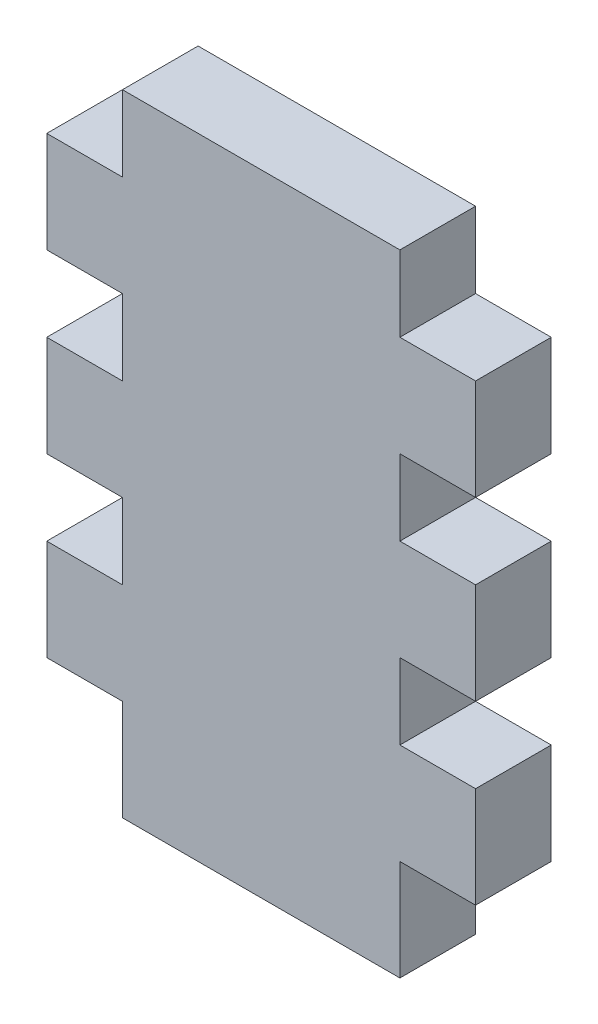
from build123d import *

# Parameters (mm, degrees)
SKETCH1_W           = 14
SKETCH1_H           = 25
BOSS_EXTRUDE1_DEPTH = 3
SKETCH3_W           = 3
SKETCH3_H           = 3
SKETCH3_H_2         = 4
CUT_EXTRUDE2_DEPTH  = 3
SKETCH4_W           = 3
SKETCH4_H           = 4
BOSS_EXTRUDE2_DEPTH = 3


with BuildPart() as part:
    # Sketch1 → Boss-Extrude1 (new body)
    with BuildSketch(Plane.XY):
        Rectangle(SKETCH1_W, SKETCH1_H)
    extrude(amount=BOSS_EXTRUDE1_DEPTH)

    # Sketch3 → Cut-Extrude2 (cut)
    with BuildSketch(Plane.XY.offset(3)):
        with Locations((-5.5, 11)):
            Rectangle(SKETCH3_W, SKETCH3_H)
        with Locations((-5.5, 4)):
            Rectangle(SKETCH3_W, SKETCH3_H)
        with Locations((-5.5, -3)):
            Rectangle(SKETCH3_W, SKETCH3_H)
        with Locations((-5.5, -10.5)):
            Rectangle(SKETCH3_W, SKETCH3_H_2)
    extrude(amount=-CUT_EXTRUDE2_DEPTH, mode=Mode.SUBTRACT)

    # Sketch4 → Boss-Extrude2 (add)
    with BuildSketch(Plane.XY.offset(3)):
        with Locations((8.5, 7.5)):
            Rectangle(SKETCH4_W, SKETCH4_H)
        with Locations((8.5, 0.5)):
            Rectangle(SKETCH4_W, SKETCH4_H)
        with Locations((8.5, -6.5)):
            Rectangle(SKETCH4_W, SKETCH4_H)
    extrude(amount=-BOSS_EXTRUDE2_DEPTH)


solid = part.part
